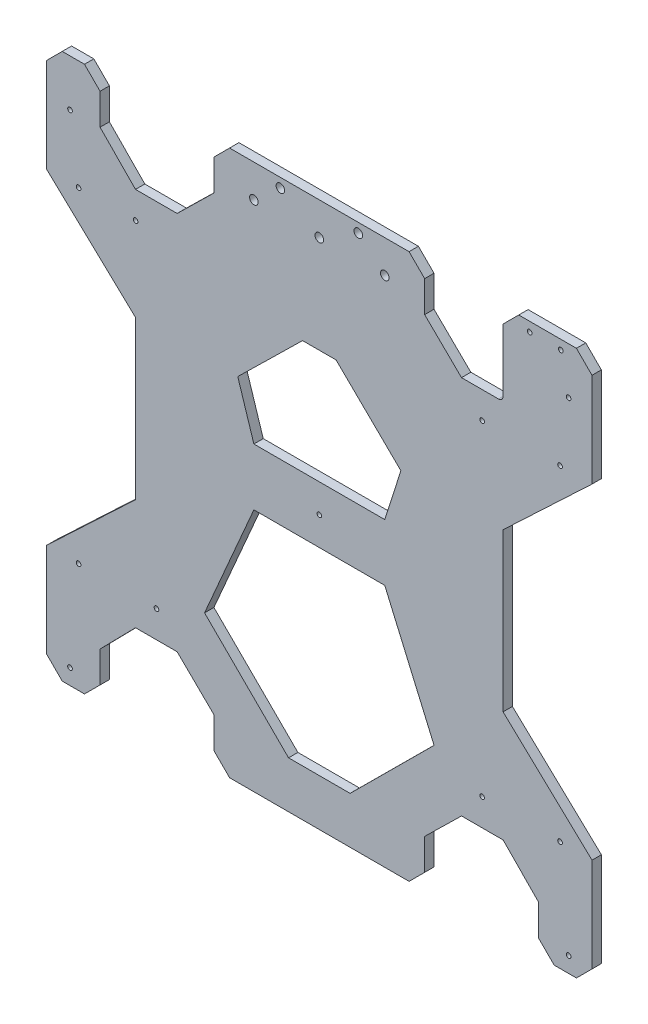
from build123d import *

# Parameters (mm, degrees)
SCHIZZO13_R                  = 1.5
SCHIZZO13_R_2                = 2.75
ESTRUSIONE_ESTRUSIONE2_DEPTH = 6


with BuildPart() as part:
    # Schizzo13 → Estrusione-Estrusione2 (new body)
    with BuildSketch(Plane.XY):
        with BuildLine():
            Line((10, 0), (24.28195797, 0))
            Line((24.28195797, 0), (34.28195797, 10))
            Line((34.28195797, 10), (34.28195797, 30))
            Line((34.28195797, 30), (57.017366293, 53.192694567))
            Line((57.017366293, 53.192694567), (83.745372993, 53.192694567))
            Line((83.745372993, 53.192694567), (107.404551383, 30))
            Line((107.404551383, 30), (107.404551383, 10))
            Line((107.404551383, 10), (117.404551383, 0))
            Line((117.404551383, 0), (232.595448617, 0))
            Line((232.595448617, 0), (242.595448617, 10))
            Line((242.595448617, 10), (242.595448617, 30))
            Line((242.595448617, 30), (266.254627007, 53.192694567))
            Line((266.254627007, 53.192694567), (292.982633707, 53.192694567))
            Line((292.982633707, 53.192694567), (315.71804203, 30))
            Line((315.71804203, 30), (315.71804203, 10))
            Line((315.71804203, 10), (325.71804203, 0))
            Line((325.71804203, 0), (340, 0))
            Line((340, 0), (350, 10))
            Line((350, 10), (350, 70.5))
            Line((350, 70.5), (292.919241786, 124.388863529))
            Line((292.919241786, 124.388863529), (292.919241786, 225.611136471))
            Line((292.919241786, 225.611136471), (350, 279.5))
            Line((350, 279.5), (350, 340))
            Line((350, 340), (340, 350))
            Line((340, 350), (302.982633707, 350))
            Line((302.982633707, 350), (292.982633707, 340))
            Line((292.982633707, 340), (292.982633707, 299.807305433))
            ThreePointArc((292.982633707, 299.807305433), (292.103954051, 297.685985089), (289.982633707, 296.807305433))
            Line((289.982633707, 296.807305433), (266.254627007, 296.807305433))
            Line((266.254627007, 296.807305433), (242.595448617, 320))
            Line((242.595448617, 320), (242.595448617, 340))
            Line((242.595448617, 340), (232.595448617, 350))
            Line((232.595448617, 350), (117.404551383, 350))
            Line((117.404551383, 350), (107.404551383, 340))
            Line((107.404551383, 340), (107.404551383, 320))
            Line((107.404551383, 320), (83.745372993, 296.807305433))
            Line((83.745372993, 296.807305433), (57.017366293, 296.807305433))
            Line((57.017366293, 296.807305433), (34.28195797, 320))
            Line((34.28195797, 320), (34.28195797, 340))
            Line((34.28195797, 340), (24.28195797, 350))
            Line((24.28195797, 350), (10, 350))
            Line((10, 350), (0, 340))
            Line((0, 340), (0, 279.5))
            Line((0, 279.5), (57.080758214, 225.611136471))
            Line((57.080758214, 225.611136471), (57.080758214, 175))
            Line((57.080758214, 175), (57.080758214, 124.388863529))
            Line((57.080758214, 124.388863529), (0, 70.5))
            Line((0, 70.5), (0, 10))
            Line((0, 10), (10, 0))
        make_face()
        with Locations((15, 320)):
            Circle(SCHIZZO13_R, mode=Mode.SUBTRACT)
        with Locations((20.5, 279.5)):
            Circle(SCHIZZO13_R, mode=Mode.SUBTRACT)
        with Locations((57.080758214, 279.5)):
            Circle(SCHIZZO13_R, mode=Mode.SUBTRACT)
        with Locations((175, 175)):
            Circle(SCHIZZO13_R, mode=Mode.SUBTRACT)
        with Locations((20.5, 70.5)):
            Circle(SCHIZZO13_R, mode=Mode.SUBTRACT)
        with Locations((200, 344)):
            Circle(SCHIZZO13_R_2, mode=Mode.SUBTRACT)
        with Locations(Location((150, 344, 0), (0, 0, 180))):
            Circle(SCHIZZO13_R_2, mode=Mode.SUBTRACT)
        with Locations((175, 329)):
            Circle(SCHIZZO13_R_2, mode=Mode.SUBTRACT)
        with Locations((217, 329)):
            Circle(SCHIZZO13_R_2, mode=Mode.SUBTRACT)
        with Locations(Location((133, 329, 0), (0, 0, 180))):
            Circle(SCHIZZO13_R_2, mode=Mode.SUBTRACT)
        with Locations((70.5, 70.5)):
            Circle(SCHIZZO13_R, mode=Mode.SUBTRACT)
        with Locations((279.5, 70.5)):
            Circle(SCHIZZO13_R, mode=Mode.SUBTRACT)
        with Locations((329.5, 70.5)):
            Circle(SCHIZZO13_R, mode=Mode.SUBTRACT)
        with Locations((335, 10)):
            Circle(SCHIZZO13_R, mode=Mode.SUBTRACT)
        with Locations((15, 10)):
            Circle(SCHIZZO13_R, mode=Mode.SUBTRACT)
        with Locations((279.5, 279.5)):
            Circle(SCHIZZO13_R, mode=Mode.SUBTRACT)
        with Locations((329.5, 279.5)):
            Circle(SCHIZZO13_R, mode=Mode.SUBTRACT)
        with Locations((335, 320)):
            Circle(SCHIZZO13_R, mode=Mode.SUBTRACT)
        with Locations((310, 344)):
            Circle(SCHIZZO13_R, mode=Mode.SUBTRACT)
        with Locations((330, 344)):
            Circle(SCHIZZO13_R, mode=Mode.SUBTRACT)
        Polygon((217, 193.286910978), (227.343033378, 225.611136471), (185.750894453, 266.383210572), (164.249105547, 266.383210572), (122.656966622, 225.611136471), (133, 193.286910978), align=None, mode=Mode.SUBTRACT)
        Polygon((133, 156.713089022), (101.348199345, 83.616789428), (155.254193112, 30), (194.745806888, 30), (248.651800655, 83.616789428), (217, 156.713089022), align=None, mode=Mode.SUBTRACT)
    extrude(amount=-ESTRUSIONE_ESTRUSIONE2_DEPTH)


solid = part.part
